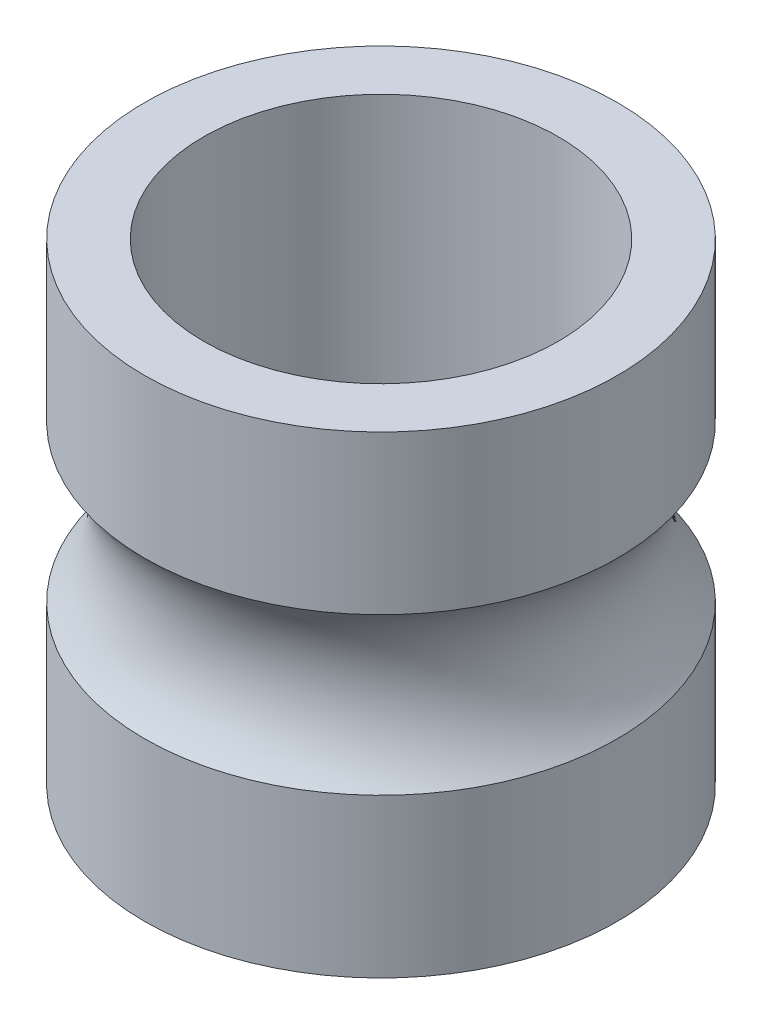
from build123d import *

# Parameters (mm, degrees)
DIAMETER_PROFILE_SKETCH_R     = 2
DIAMETER_PROFILE_SKETCH_R_2   = 1.5
DIAMETER_PROFILE_DEPTH        = 2
BEARING_PATH_PROFILE_SKETCH_R = 1


with BuildPart() as part:
    # Diameter Profile Sketch → Diameter Profile (new, symmetric)
    with BuildSketch(Plane(origin=(0, 0, 0), x_dir=(1, 0, 0), z_dir=(0, 1, 0))):
        with Locations(Location((0, 0, 0), (0, 0, 270))):
            Circle(DIAMETER_PROFILE_SKETCH_R)
        with Locations(Location((0, 0, 0), (0, 0, 270))):
            Circle(DIAMETER_PROFILE_SKETCH_R_2, mode=Mode.SUBTRACT)
    extrude(amount=DIAMETER_PROFILE_DEPTH, both=True)

    # Bearing Path Profile Sketch → Bearing Path Profile (revolve, cut)
    with BuildSketch(Plane.XY, mode=Mode.PRIVATE) as bearing_path_profile_sk:
        with Locations((2.75, 0)):
            Circle(BEARING_PATH_PROFILE_SKETCH_R)
    revolve(bearing_path_profile_sk.sketch.rotate(Axis((0, 2, 0), (0, -1, 0)), 90), axis=Axis((0, 2, 0), (0, -1, 0)), mode=Mode.SUBTRACT)


solid = part.part
